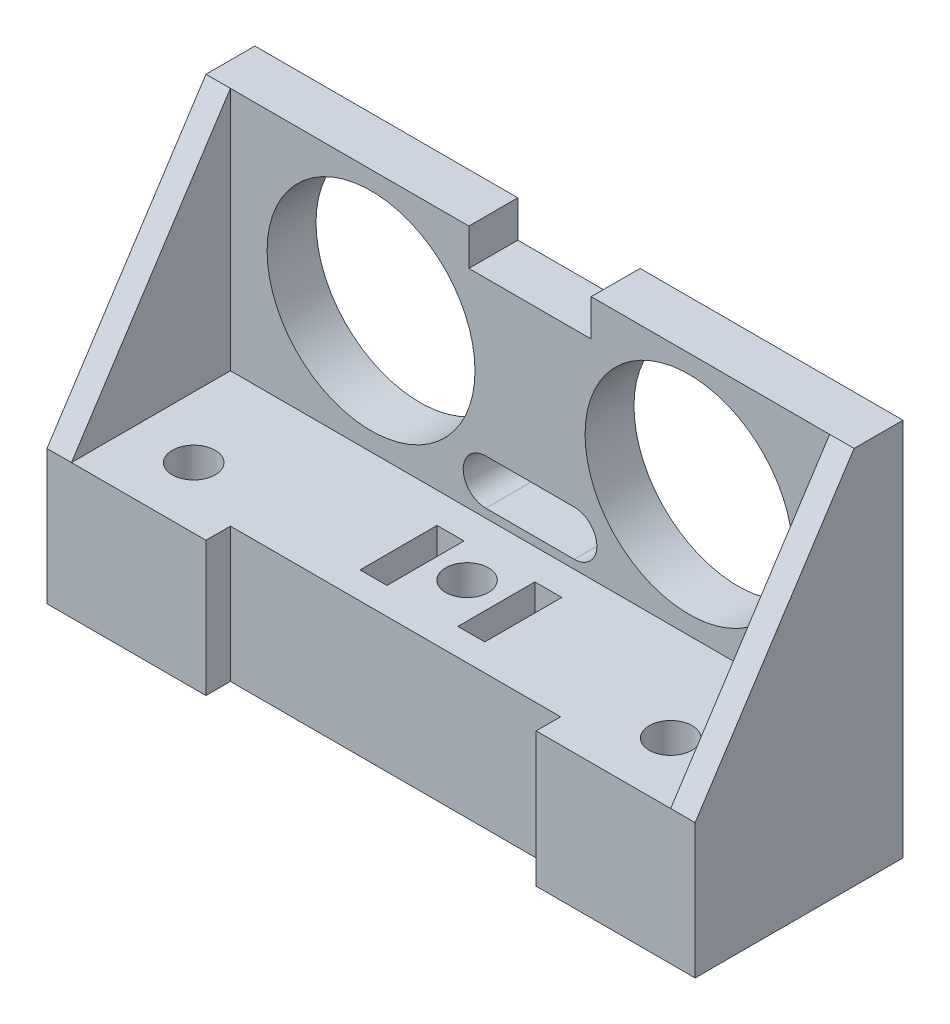
from build123d import *

# Parameters (mm, degrees)
SKETCH1_R           = 8.5
BOSS_EXTRUDE1_DEPTH = 4
BOSS_EXTRUDE2_DEPTH = 13
SKETCH3_W           = 2.2
SKETCH3_H           = 6.3
CUT_EXTRUDE1_DEPTH  = 3.5
SKETCH4_R           = 1.75
CUT_EXTRUDE2_DEPTH  = 47.663174732
SKETCH6_W           = 13.5
SKETCH6_H           = 2
CUT_EXTRUDE4_DEPTH  = 47.663174732
SKETCH7_W           = 2
SKETCH7_H           = 25
BOSS_EXTRUDE3_DEPTH = 17
CUT_EXTRUDE5_DEPTH  = 72
SKETCH9_R           = 1.75
BOSS_EXTRUDE4_DEPTH = 6
SKETCH10_R          = 2.85
CUT_EXTRUDE6_DEPTH  = 8


with BuildPart() as part:
    # Sketch1 → Boss-Extrude1 (new body)
    with BuildSketch(Plane.XY):
        Polygon((-10.41954023, 18.706896552), (-10.41954023, -6.293103448), (38.58045977, -6.293103448), (38.58045977, 18.706896552), (19.08045977, 18.706896552), (19.08045977, 15.706896552), (14.08045977, 15.706896552), (9.08045977, 15.706896552), (9.08045977, 18.706896552), align=None)
        with BuildLine():
            ThreePointArc((10.46545977, -0.583103448), (8.61545977, 1.266896552), (10.46545977, 3.116896552))
            Line((10.46545977, 3.116896552), (17.69545977, 3.116896552))
            ThreePointArc((17.69545977, 3.116896552), (19.54545977, 1.266896552), (17.69545977, -0.583103448))
            Line((17.69545977, -0.583103448), (10.46545977, -0.583103448))
        make_face(mode=Mode.SUBTRACT)
        with Locations((1.08045977, 8.706896552)):
            Circle(SKETCH1_R, mode=Mode.SUBTRACT)
        with Locations((27.08045977, 8.706896552)):
            Circle(SKETCH1_R, mode=Mode.SUBTRACT)
    extrude(amount=BOSS_EXTRUDE1_DEPTH)

    # Sketch2 → Boss-Extrude2 (add)
    with BuildSketch(Plane.XY.offset(4)):
        Polygon((14.08045977, -1.293103448), (38.58045977, -1.293103448), (38.58045977, -6.293103448), (-10.41954023, -6.293103448), (-10.41954023, -1.293103448), align=None)
    extrude(amount=BOSS_EXTRUDE2_DEPTH)

    # Sketch3 → Cut-Extrude1 (cut)
    with BuildSketch(Plane(origin=(0, -1.293103448, 0), x_dir=(1, 0, 0), z_dir=(0, 1, 0))):
        with Locations((10.08045977, -9.65)):
            Rectangle(SKETCH3_W, SKETCH3_H)
        with Locations((18.08045977, -9.65)):
            Rectangle(SKETCH3_W, SKETCH3_H)
    extrude(amount=-CUT_EXTRUDE1_DEPTH, mode=Mode.SUBTRACT)

    # Sketch4 → Cut-Extrude2 (cut, through all)
    with BuildSketch(Plane(origin=(0, -1.293103448, 0), x_dir=(1, 0, 0), z_dir=(0, 1, 0))):
        with Locations(Location((14.08045977, -9.15, 0), (0, 0, 270))):
            Circle(SKETCH4_R)
        with Locations(Location((33.58045977, -12, 0), (0, 0, 270))):
            Circle(SKETCH4_R)
        with Locations(Location((-5.41954023, -12, 0), (0, 0, 90))):
            Circle(SKETCH4_R)
    extrude(amount=-CUT_EXTRUDE2_DEPTH, mode=Mode.SUBTRACT)

    # Sketch6 → Cut-Extrude4 (cut, through all)
    with BuildSketch(Plane(origin=(0, -1.293103448, 0), x_dir=(1, 0, 0), z_dir=(0, 1, 0))):
        with Locations((7.33045977, -16)):
            Rectangle(SKETCH6_W, SKETCH6_H)
        with Locations((20.83045977, -16)):
            Rectangle(SKETCH6_W, SKETCH6_H)
    extrude(amount=-CUT_EXTRUDE4_DEPTH, mode=Mode.SUBTRACT)

    # Sketch7 → Boss-Extrude3 (add)
    with BuildSketch(Plane(origin=(0, 0, 0), x_dir=(-1, 0, 0), z_dir=(0, 0, -1))):
        with Locations((-39.58045977, 6.206896552)):
            Rectangle(SKETCH7_W, SKETCH7_H)
        with Locations((11.41954023, 6.206896552)):
            Rectangle(SKETCH7_W, SKETCH7_H)
    extrude(amount=-BOSS_EXTRUDE3_DEPTH)

    # Sketch8 → Cut-Extrude5 (cut)
    with BuildSketch(Plane(origin=(40.58045977, 0, 0), x_dir=(0, 0, -1), z_dir=(1, 0, 0))):
        Polygon((-4, 18.706896552), (-17, -1.293103448), (-17, 18.706896552), align=None)
    extrude(amount=-CUT_EXTRUDE5_DEPTH, mode=Mode.SUBTRACT)

    # Sketch9 → Boss-Extrude4 (add)
    with BuildSketch(Plane(origin=(0, -6.293103448, 0), x_dir=(-1, 0, 0), z_dir=(0, -1, 0))):
        Polygon((-40.58045977, 0), (-40.58045977, -17), (-27.58045977, -17), (-27.58045977, -15), (-0.58045977, -15), (-0.58045977, -17), (12.41954023, -17), (12.41954023, 0), align=None)
        with Locations(Location((5.41954023, -12, 0), (0, 0, 90))):
            Circle(SKETCH9_R, mode=Mode.SUBTRACT)
        with Locations(Location((-14.08045977, -9.15, 0), (0, 0, 270))):
            Circle(SKETCH9_R, mode=Mode.SUBTRACT)
        with Locations(Location((-33.58045977, -12, 0), (0, 0, 270))):
            Circle(SKETCH9_R, mode=Mode.SUBTRACT)
    extrude(amount=BOSS_EXTRUDE4_DEPTH)

    # Sketch10 → Cut-Extrude6 (cut)
    with BuildSketch(Plane(origin=(0, -12.293103448, 0), x_dir=(-1, 0, 0), z_dir=(0, -1, 0))):
        with Locations(Location((-14.08045977, -9.15, 0), (0, 0, 90))):
            Circle(SKETCH10_R)
    extrude(amount=-CUT_EXTRUDE6_DEPTH, mode=Mode.SUBTRACT)


solid = part.part
